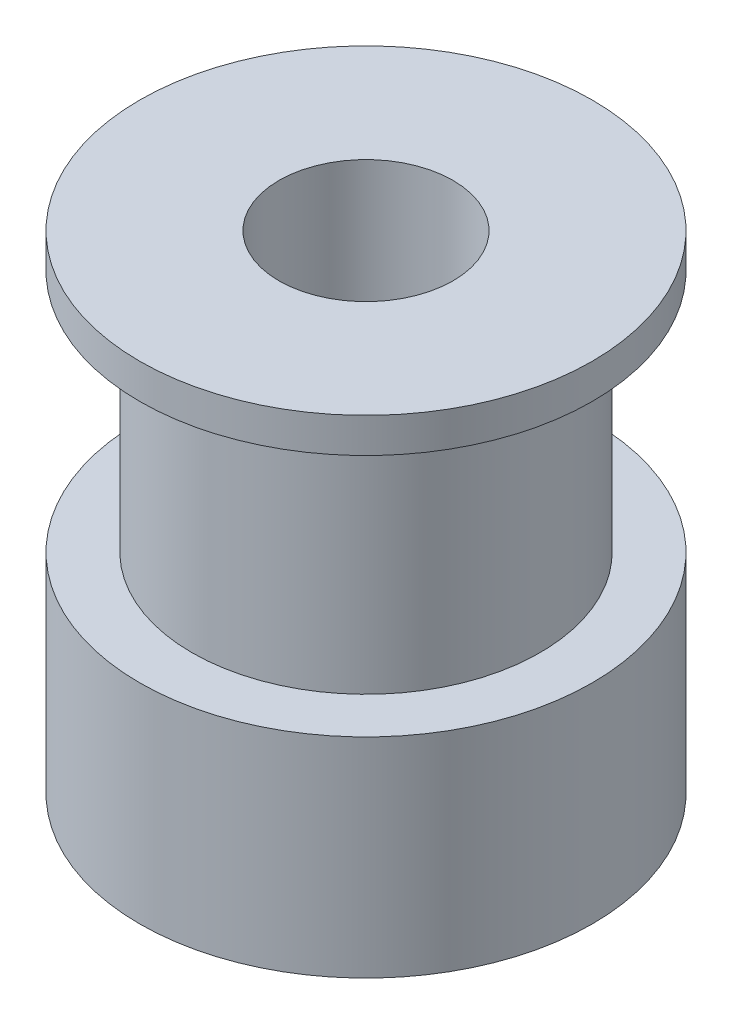
from build123d import *

# Parameters (mm, degrees)
SKETCH1_R           = 6.5
BOSS_EXTRUDE1_DEPTH = 6
SKETCH2_R           = 5
BOSS_EXTRUDE2_DEPTH = 7
SKETCH3_R           = 6.5
BOSS_EXTRUDE3_DEPTH = 1
SKETCH4_R           = 2.5
CUT_EXTRUDE1_DEPTH  = 30


with BuildPart() as part:
    # Sketch1 → Boss-Extrude1 (new body)
    with BuildSketch(Plane(origin=(0, 0, 0), x_dir=(1, 0, 0), z_dir=(0, 1, 0))):
        with Locations(Location((0, 0, 0), (0, 0, 270))):
            Circle(SKETCH1_R)
    extrude(amount=BOSS_EXTRUDE1_DEPTH)

    # Sketch2 → Boss-Extrude2 (add)
    with BuildSketch(Plane(origin=(0, 6, 0), x_dir=(1, 0, 0), z_dir=(0, 1, 0))):
        with Locations(Location((0, 0, 0), (0, 0, 270))):
            Circle(SKETCH2_R)
    extrude(amount=BOSS_EXTRUDE2_DEPTH)

    # Sketch3 → Boss-Extrude3 (add)
    with BuildSketch(Plane(origin=(0, 13, 0), x_dir=(1, 0, 0), z_dir=(0, 1, 0))):
        with Locations(Location((0, 0, 0), (0, 0, 270))):
            Circle(SKETCH3_R)
    extrude(amount=BOSS_EXTRUDE3_DEPTH)

    # Sketch4 → Cut-Extrude1 (cut)
    with BuildSketch(Plane(origin=(0, 14, 0), x_dir=(1, 0, 0), z_dir=(0, 1, 0))):
        with Locations(Location((0, 0, 0), (0, 0, 270))):
            Circle(SKETCH4_R)
    extrude(amount=-CUT_EXTRUDE1_DEPTH, mode=Mode.SUBTRACT)


solid = part.part
